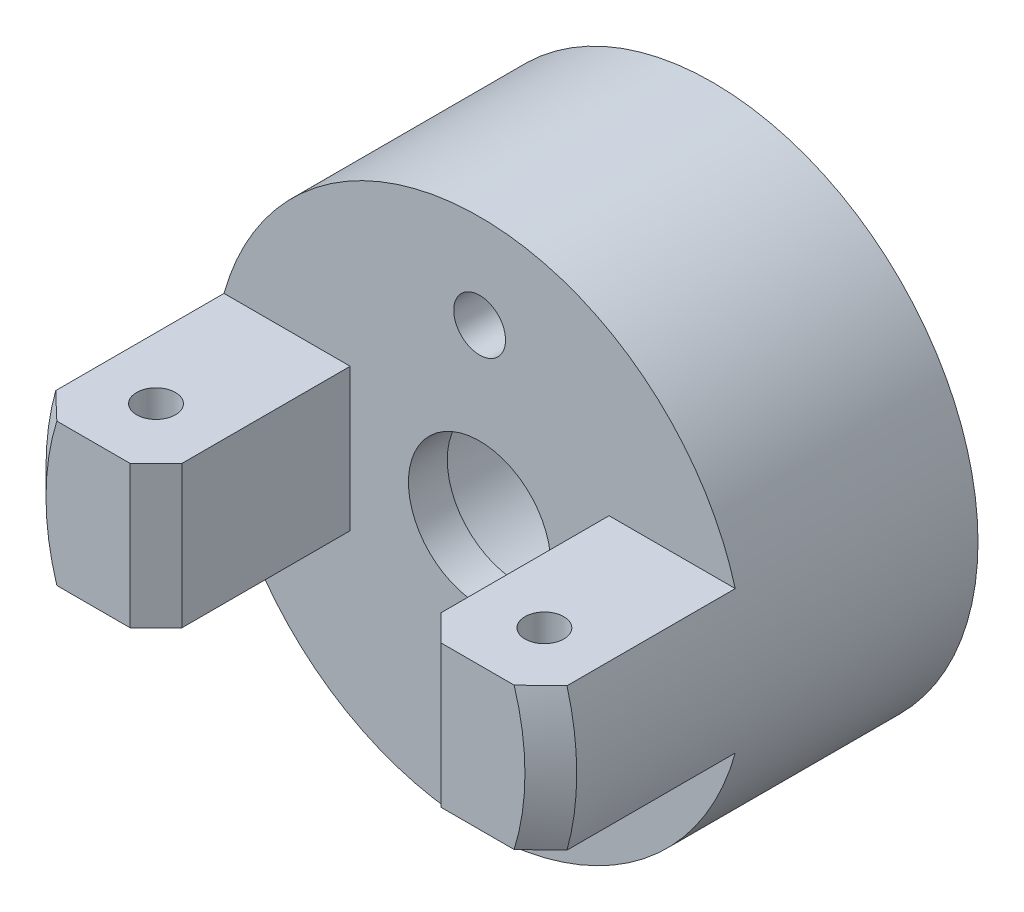
from build123d import *

# Parameters (mm, degrees)
SKETCH_1_R          = 20.5
EXTRUDE_1_DEPTH     = 33
CUT_EXTRUDE_1_DEPTH = 15
SKETCH_3_R          = 5
SKETCH_3_R_2        = 2
CUT_EXTRUDE_2_DEPTH = 35.124771062
CHAMFER_1_SIZE      = 2
SKETCH_4_R          = 1.5
CUT_EXTRUDE_3_DEPTH = 15
SKETCH_6_R          = 5.5
CUT_EXTRUDE_4_DEPTH = 35.124771062
SKETCH_9_R          = 7.5
CUT_EXTRUDE_7_DEPTH = 15


with BuildPart() as part:
    # Эскиз1 → Вытянуть1 (new body)
    with BuildSketch(Plane.XY):
        Circle(SKETCH_1_R)
    extrude(amount=EXTRUDE_1_DEPTH)

    # Эскиз2 → Вырез-Вытянуть1 (cut)
    with BuildSketch(Plane.XY.offset(33)):
        Polygon((10, 5.5), (24.402362137, 5.5), (24.402362137, 27.166317261), (-29.05675736, 27.166317261), (-29.05675736, 5.5), (-10, 5.5), (-10, -5.5), (-25.152295152, -5.5), (-25.152295152, -27.51572327), (25.537931669, -27.51572327), (25.537931669, -5.5), (10, -5.5), align=None)
    extrude(amount=-CUT_EXTRUDE_1_DEPTH, mode=Mode.SUBTRACT)

    # Эскиз3 → Вырез-Вытянуть2 (cut, through all)
    with BuildSketch(Plane.XY.offset(18)):
        Circle(SKETCH_3_R)
        with Locations((0, 13.25)):
            Circle(SKETCH_3_R_2)
        with Locations((0, -13.25)):
            Circle(SKETCH_3_R_2)
    extrude(amount=-CUT_EXTRUDE_2_DEPTH, mode=Mode.SUBTRACT)

    # Фаска1
    chamfer_1_edges = [part.edges().sort_by_distance(p)[0] for p in [
        (-10, 0, 33),
        (10, 0, 33),
        (-20.5, 0, 33),
        (20.311235339, -2.775557422, 33),
    ]]
    chamfer(chamfer_1_edges, length=CHAMFER_1_SIZE)

    # Эскиз4 → Вырез-Вытянуть3 (cut)
    with BuildSketch(Plane.XZ.offset(5.5)):
        with Locations((-15, 28)):
            Circle(SKETCH_4_R)
        with Locations((15, 28)):
            Circle(SKETCH_4_R)
    extrude(amount=-CUT_EXTRUDE_3_DEPTH, mode=Mode.SUBTRACT)

    # Эскиз6 → Вырез-Вытянуть4 (cut, through all)
    with BuildSketch(Plane.XY.offset(18)):
        Circle(SKETCH_6_R)
    extrude(amount=-CUT_EXTRUDE_4_DEPTH, mode=Mode.SUBTRACT)

    # Эскиз9 → Вырез-Вытянуть7 (cut)
    with BuildSketch(Plane(origin=(0, 0, 0), x_dir=(-1, 0, 0), z_dir=(0, 0, -1))):
        Circle(SKETCH_9_R)
    extrude(amount=-CUT_EXTRUDE_7_DEPTH, mode=Mode.SUBTRACT)


solid = part.part
